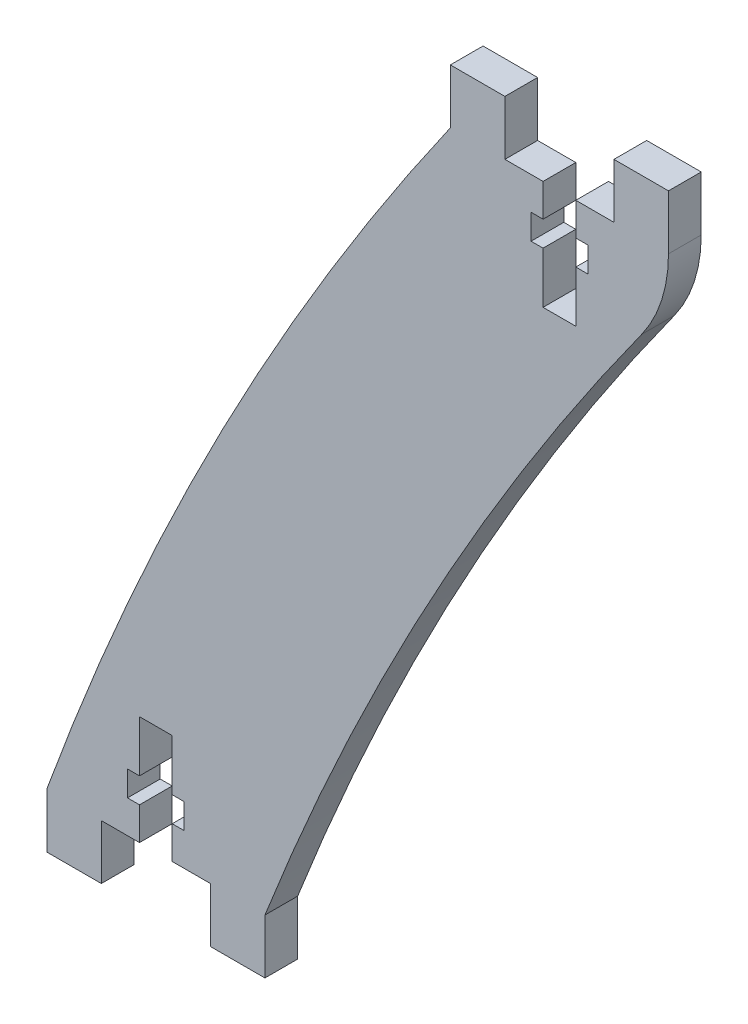
from build123d import *

# Parameters (mm, degrees)
BOSS_EXTRUDE1_DEPTH = 3


with BuildPart() as part:
    # Sketch1 → Boss-Extrude1 (new body)
    with BuildSketch(Plane.XY):
        with BuildLine():
            Line((61.5, 71), (65, 71))
            Line((65, 71), (65, 76))
            Line((65, 76), (70, 76))
            Line((70, 76), (70, 71))
            ThreePointArc((70, 71), (69.368032654, 66.988756089), (67.533356838, 63.366129268))
            ThreePointArc((67.533356838, 63.366129268), (48.266790444, 32.772966225), (33, 0))
            Line((33, 0), (33, -5))
            Line((33, -5), (28, -5))
            Line((28, -5), (28, 0))
            Line((28, 0), (24.5, 0))
            Line((24.5, 0), (24.5, 3))
            Line((24.5, 3), (25.6, 3))
            Line((25.6, 3), (25.6, 5.3))
            Line((25.6, 5.3), (24.5, 5.3))
            Line((24.5, 5.3), (24.5, 10))
            Line((24.5, 10), (21.5, 10))
            Line((21.5, 10), (21.5, 5.3))
            Line((21.5, 5.3), (20.4, 5.3))
            Line((20.4, 5.3), (20.4, 3))
            Line((20.4, 3), (21.5, 3))
            Line((21.5, 3), (21.5, 0))
            Line((21.5, 0), (18, 0))
            Line((18, 0), (18, -5))
            Line((18, -5), (13, -5))
            Line((13, -5), (13, 0))
            ThreePointArc((13, 0), (29.165358552, 36.716644135), (50, 71))
            Line((50, 71), (50, 76))
            Line((50, 76), (55, 76))
            Line((55, 76), (55, 71))
            Line((55, 71), (58.5, 71))
            Line((58.5, 71), (58.5, 68))
            Line((58.5, 68), (57.4, 68))
            Line((57.4, 68), (57.4, 65.7))
            Line((57.4, 65.7), (58.5, 65.7))
            Line((58.5, 65.7), (58.5, 61))
            Line((58.5, 61), (61.5, 61))
            Line((61.5, 61), (61.5, 65.7))
            Line((61.5, 65.7), (62.6, 65.7))
            Line((62.6, 65.7), (62.6, 68))
            Line((62.6, 68), (61.5, 68))
            Line((61.5, 68), (61.5, 71))
        make_face()
    extrude(amount=BOSS_EXTRUDE1_DEPTH)


solid = part.part
